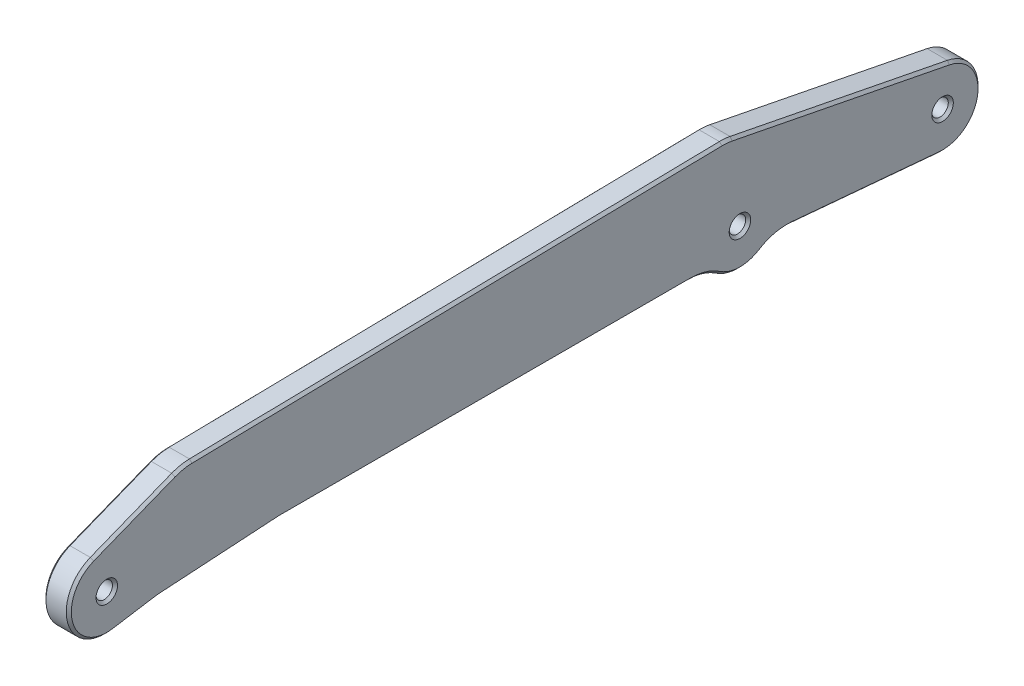
from build123d import *

# Parameters (mm, degrees)
SKETCH_1_R          = 1.625
SKETCH_1_R_2        = 1.575
EXTRUDE_1_DEPTH     = 5
CHAMFER_1_SIZE      = 0.5
CUT_EXTRUDE_1_DEPTH = 10
FILLET_1_R          = 1.8
CHAMFER_2_SIZE      = 0.5
EXTRUDE_2_DEPTH     = 5


with BuildPart() as part:
    # 草图1 → 凸台-拉伸1 (new body)
    with BuildSketch(Plane(origin=(2.5, 0, 0), x_dir=(0, 0, -1), z_dir=(1, 0, 0))):
        with BuildLine():
            Line((10.174472616, -4.871984543), (39.334317565, -7.47039938))
            ThreePointArc((39.334317565, -7.47039938), (47.425031601, -1.057783404), (41.446954522, 7.359097948))
            Line((41.446954522, 7.359097948), (-1.452294145, 15.793998839))
            ThreePointArc((-1.452294145, 15.793998839), (-2.504982909, 15.943374182), (-3.567581162, 15.980138025))
            Line((-3.567581162, 15.980138025), (-108.190291563, 14.033668994))
            ThreePointArc((-108.190291563, 14.033668994), (-109.968090242, 13.840675264), (-111.68308982, 13.334126973))
            Line((-111.68308982, 13.334126973), (-127.759109434, 6.974045822))
            ThreePointArc((-127.759109434, 6.974045822), (-132.233383985, -1.981957648), (-123.818844483, -7.406407472))
            Line((-123.818844483, -7.406407472), (-115.473023263, -6.075436578))
            ThreePointArc((-115.473023263, -6.075436578), (-114.998738119, -6.011395859), (-114.521932102, -5.970120756))
            Line((-114.521932102, -5.970120756), (-91.311587443, -4.519474215))
            ThreePointArc((-91.311587443, -4.519474215), (-90.999847969, -4.50486974), (-90.687804581, -4.5))
            Line((-90.687804581, -4.5), (-9.797958971, -4.5))
            ThreePointArc((-9.797958971, -4.5), (-6.870258752, -4.938171125), (-4.199125273, -6.214285714))
            ThreePointArc((-4.199125273, -6.214285714), (-0.130653307, -7.498861895), (3.980098301, -6.356793021))
            ThreePointArc((3.980098301, -6.356793021), (6.955899906, -5.107988421), (10.174472616, -4.871984543))
        make_face()
        with Locations(Location((-125, 0, 0), (0, 0, 180))):
            Circle(SKETCH_1_R, mode=Mode.SUBTRACT)
        with Locations(Location((0, 0, 0), (0, 0, 180))):
            Circle(SKETCH_1_R, mode=Mode.SUBTRACT)
        with Locations(Location((-106.5, 5, 0), (0, 0, 180))):
            Circle(SKETCH_1_R_2, mode=Mode.SUBTRACT)
        with Locations(Location((-23.5, 8.5, 0), (0, 0, 180))):
            Circle(SKETCH_1_R_2, mode=Mode.SUBTRACT)
        with Locations(Location((40, 0, 0), (0, 0, 180))):
            Circle(SKETCH_1_R, mode=Mode.SUBTRACT)
        with BuildLine():
            Line((-97.531579662, 6.980715987), (-32.542826067, 8.189809077))
            ThreePointArc((-32.542826067, 8.189809077), (-30.505969245, 6.227357985), (-32.468420338, 4.190501164))
            Line((-32.468420338, 4.190501164), (-97.457173933, 2.981408074))
            ThreePointArc((-97.457173933, 2.981408074), (-99.494030755, 4.943859166), (-97.531579662, 6.980715987))
        make_face(mode=Mode.SUBTRACT)
    extrude(amount=-EXTRUDE_1_DEPTH)

    # 倒角1
    chamfer_1_edges = [part.edges().sort_by_distance(p)[0] for p in [
        (-2.5, -1.057783404, -47.425031601),
        (2.5, -7.498861895, 0.130653307),
        (2.5, -4.938171125, 6.870258752),
        (2.5, -4.5, 50.242881776),
        (-2.5, 11.576548393, -19.997330188),
        (2.5, -4.50486974, 90.999847969),
        (2.5, -5.244797486, 102.916759772),
        (2.5, -6.011395859, 114.998738119),
        (2.5, -6.740922025, 119.645933873),
        (2.5, -1.981957648, 132.233383985),
        (2.5, 10.154086398, 119.721099627),
        (2.5, 13.840675264, 109.968090242),
        (2.5, 15.00690351, 55.878936363),
        (2.5, 15.943374182, 2.504982909),
        (2.5, 11.576548393, -19.997330188),
        (-2.5, 15.943374182, 2.504982909),
        (2.5, -1.057783404, -47.425031601),
        (2.5, -6.171191961, -24.754395091),
        (2.5, -5.107988421, -6.955899906),
        (-2.5, 15.00690351, 55.878936363),
        (-2.5, 13.840675264, 109.968090242),
        (-2.5, 10.154086398, 119.721099627),
        (-2.5, -1.981957648, 132.233383985),
        (-2.5, 0, 123.375),
        (2.5, 0, 123.375),
        (-2.5, -6.740922025, 119.645933873),
        (-2.5, 0, -1.625),
        (2.5, 0, -1.625),
        (-2.5, -6.011395859, 114.998738119),
        (-2.5, -5.244797486, 102.916759772),
        (-2.5, -5.107988421, -6.955899906),
        (-2.5, 4.943859166, 99.494030755),
        (-2.5, 7.585262532, 65.037202864),
        (-2.5, 6.227357985, 30.505969245),
        (-2.5, 3.585954619, 64.962797136),
        (2.5, 4.943859166, 99.494030755),
        (2.5, 3.585954619, 64.962797136),
        (2.5, 6.227357985, 30.505969245),
        (-2.5, -4.50486974, 90.999847969),
        (2.5, 7.585262532, 65.037202864),
        (-2.5, -4.5, 50.242881776),
        (-2.5, 5, 104.925),
        (-2.5, -4.938171125, 6.870258752),
        (2.5, 5, 104.925),
        (-2.5, 8.5, 21.925),
        (2.5, 8.5, 21.925),
        (-2.5, -7.498861895, 0.130653307),
        (-2.5, 0, -41.625),
        (2.5, 0, -41.625),
        (-2.5, -6.171191961, -24.754395091),
    ]]
    chamfer(chamfer_1_edges, length=CHAMFER_1_SIZE)

    # Sketch 3D_1 → 切除-拉伸1 (cut)
    with BuildSketch(Plane(origin=(-2.5, 5.468748942, -29.149920979), x_dir=(0, 0.09600082768489282, 0.9953812541352262), z_dir=(-1, 0, 0))):
        Polygon((0, 0), (36.636192851, 3.601725733), (36.990280632, 0), (0.354087782, -3.601725733), align=None)
    extrude(amount=-CUT_EXTRUDE_1_DEPTH, mode=Mode.SUBTRACT)

    # 圆角1
    fillet_1_edges = [part.edges().sort_by_distance(p)[0] for p in [
        (0, 1.917651385, -28.451699987),
        (0, 5.468748942, -29.149920979),
        (0, 9.019846499, 7.669510948),
        (0, 12.570944056, 6.971289956),
    ]]
    fillet(fillet_1_edges, radius=FILLET_1_R)

    # 倒角2
    chamfer_2_edges = [part.edges().sort_by_distance(p)[0] for p in [
        (-2.5, 3.693200164, -28.800810483),
        (2.5, 3.693200164, -28.800810483),
        (-2.5, 5.468748942, -10.391094519),
        (2.5, 5.468748942, -10.391094519),
        (-2.5, 9.019846499, -11.089315511),
        (2.5, 9.019846499, -11.089315511),
        (-2.5, 10.795395278, 7.320400452),
        (2.5, 10.795395278, 7.320400452),
        (2.5, 2.536667318, -28.036109575),
        (-2.5, 2.536667318, -28.036109575),
        (2.5, 5.05315853, -28.530905046),
        (-2.5, 5.05315853, -28.530905046),
        (2.5, 9.435436911, 7.050495015),
        (-2.5, 9.435436911, 7.050495015),
        (2.5, 11.951928123, 6.555699544),
        (-2.5, 11.951928123, 6.555699544),
    ]]
    chamfer(chamfer_2_edges, length=CHAMFER_2_SIZE)

    # Sketch 3D_2 → 凸台-拉伸2 (add)
    with BuildSketch(Plane(origin=(-2.5, 6.354785771, -31.987998048), x_dir=(0, -0.04894175340151768, 0.9988016343468732), z_dir=(-1, 0, 0))):
        Polygon((0, 0), (12.737020213, 4.501231483), (35.673238201, 9.911480997), (42.944661229, 8.12460219), (37.299631195, 0.841435049), (21.568572182, -2.869244472), (5.067736736, -6.761500685), align=None)
        Polygon((63.094756945, -1.716239027), (130.07937311, -0.635871261), (143.056212123, 0), (141.536284317, 10.812456461), (76.338246536, 9.760903695), (52.568858227, 8.596192404), (48.259357211, 3.036112827), (48.527202079, -2.430056119), align=None)
    extrude(amount=-EXTRUDE_2_DEPTH)


solid = part.part
